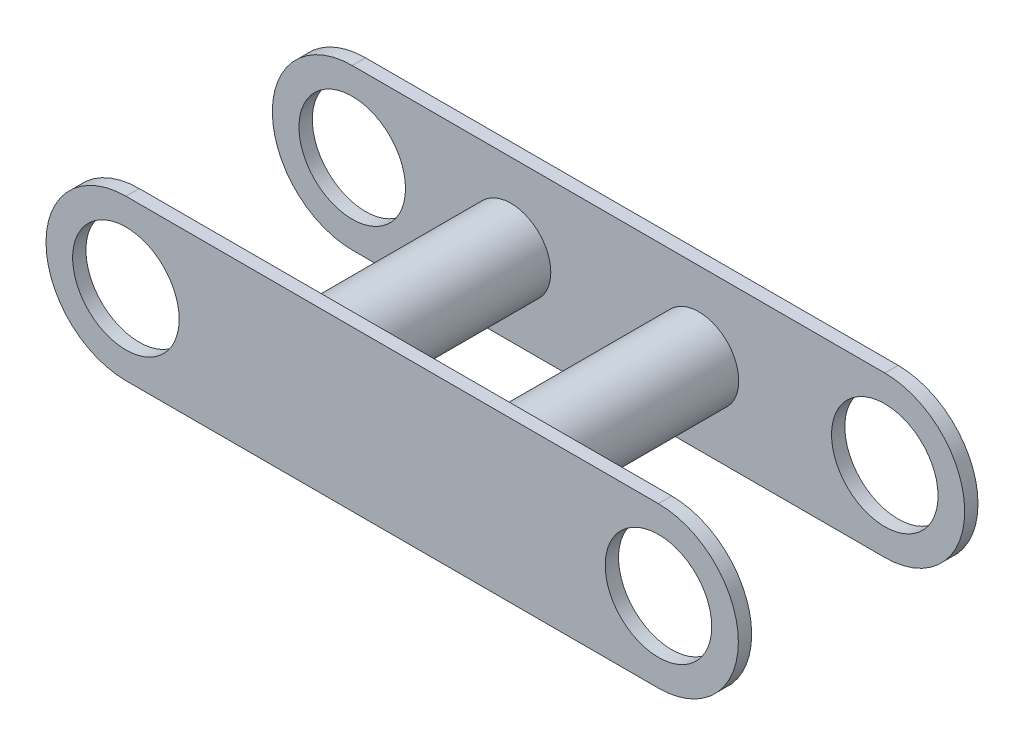
from build123d import *

# Parameters (mm, degrees)
SKETCH_1_R             = 20
EXTRUDE_3_DEPTH        = 5
SKETCH_5_R             = 15
EXTRUDE_4_DEPTH        = 80
PATTERN_LINEAR_2_COUNT = 2
PATTERN_LINEAR_2_PITCH = 85


with BuildPart() as part:
    # 草图1 → 凸台-拉伸3 (new body)
    with BuildSketch(Plane.XY):
        with BuildLine():
            Line((-21.594339623, 30), (178.405660377, 30))
            ThreePointArc((178.405660377, 30), (208.405660377, 0), (178.405660377, -30))
            Line((178.405660377, -30), (-21.594339623, -30))
            ThreePointArc((-21.594339623, -30), (-51.594339623, 0), (-21.594339623, 30))
        make_face()
        with Locations((178.405660377, 0)):
            Circle(SKETCH_1_R, mode=Mode.SUBTRACT)
        with Locations((-21.594339623, 0)):
            Circle(SKETCH_1_R, mode=Mode.SUBTRACT)
    extrude_3 = extrude(amount=EXTRUDE_3_DEPTH)

    # 草图5 → 凸台-拉伸4 (add)
    with BuildSketch(Plane.XY.offset(5)):
        with Locations((37.971935237, 0)):
            Circle(SKETCH_5_R)
        with Locations((108.550446531, 0)):
            Circle(SKETCH_5_R)
    extrude(amount=EXTRUDE_4_DEPTH)

    # 阵列(线性)2: 凸台-拉伸3 ×2
    with Locations(*[(0, 0, i * PATTERN_LINEAR_2_PITCH) for i in range(1, PATTERN_LINEAR_2_COUNT)]):
        add(extrude_3)


solid = part.part
